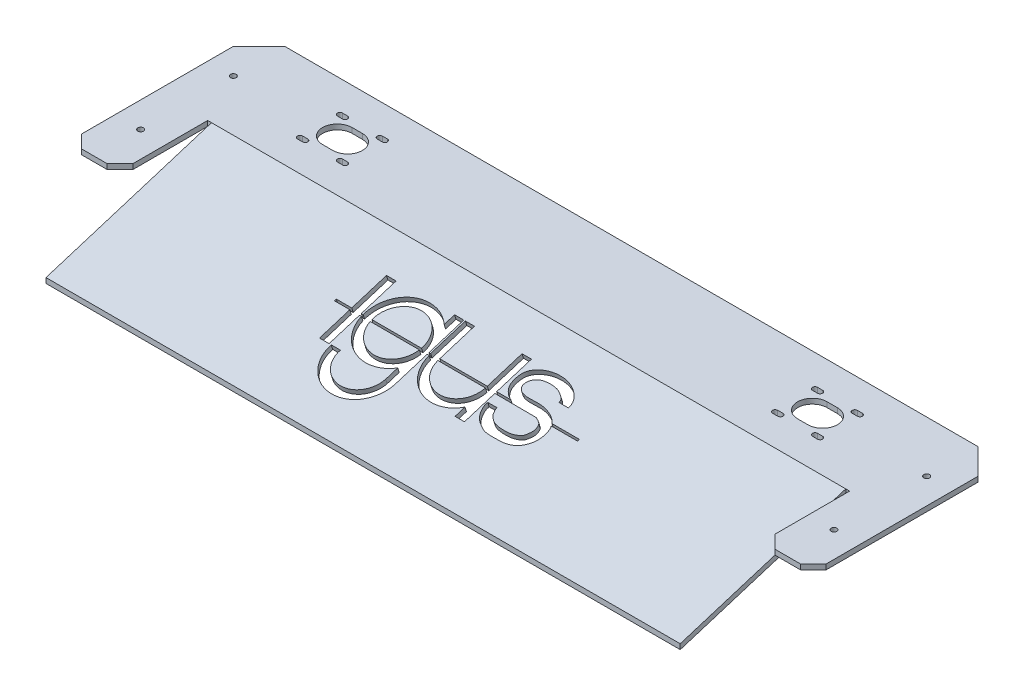
from build123d import *

# Parameters (mm, degrees)
BOSS_EXTRUDE1_DEPTH  = 4
MIRROR6_COPY_1_DEPTH = 4
MIRROR6_COPY_2_DEPTH = 4
SKETCH2_R            = 2.25
CUT_EXTRUDE1_DEPTH   = 44
CHAMFER1_SIZE        = 10
CHAMFER2_SIZE        = 10
SKETCH3_W            = 4.89133335
SKETCH3_H            = 7.534428505
SKETCH3_W_2          = 4.722258617
SKETCH3_W_3          = 4.986234694
SKETCH3_R            = 2.398576227
CUT_EXTRUDE2_DEPTH   = 10
CUT_EXTRUDE3_DEPTH   = 10
BOSS_EXTRUDE2_DEPTH  = 247
CUT_EXTRUDE4_DEPTH   = 494
SKETCH8_W            = 234.885891169
SKETCH8_H            = 80
BOSS_EXTRUDE3_DEPTH  = 4
SKETCH9_W            = 791.232351343
SKETCH9_H            = 194.819885891
CUT_EXTRUDE5_DEPTH   = 139
CHAMFER3_SIZE        = 20


with BuildPart() as part:
    # Sketch1 → Boss-Extrude1 (new body)
    with BuildSketch(Plane(origin=(0, 0, 0), x_dir=(1, 0, 0), z_dir=(0, 1, 0))):
        with BuildLine():
            Line((-290, 108.284271247), (-290, 0))
            Line((-290, 0), (-200.5, 0))
            ThreePointArc((-200.5, 0), (-197.131727984, 8.131727984), (-189, 11.5))
            Line((-189, 11.5), (-181, 11.5))
            ThreePointArc((-181, 11.5), (-172.868272016, 8.131727984), (-169.5, 0))
            Line((-169.5, 0), (0, 0))
            Line((0, 0), (0, 40))
            Line((0, 40), (-221.715728753, 40))
            Line((-221.715728753, 40), (-250, 68.284271247))
            Line((-250, 68.284271247), (-250, 108.284271247))
            Line((-250, 108.284271247), (-290, 108.284271247))
        make_face()
        with BuildLine():
            ThreePointArc((-202.499780644, 13.499780644), (-204.499780644, 15.499780644), (-202.499780644, 17.499780644))
            Line((-202.499780644, 17.499780644), (-198.499780644, 17.499780644))
            ThreePointArc((-198.499780644, 17.499780644), (-196.499780644, 15.499780644), (-198.499780644, 13.499780644))
            Line((-198.499780644, 13.499780644), (-202.499780644, 13.499780644))
        make_face(mode=Mode.SUBTRACT)
        with BuildLine():
            Line((-171.500219356, 17.499780644), (-167.500219356, 17.499780644))
            ThreePointArc((-167.500219356, 17.499780644), (-165.500219356, 15.499780644), (-167.500219356, 13.499780644))
            Line((-167.500219356, 13.499780644), (-171.500219356, 13.499780644))
            ThreePointArc((-171.500219356, 13.499780644), (-173.500219356, 15.499780644), (-171.500219356, 17.499780644))
        make_face(mode=Mode.SUBTRACT)
    boss_extrude1 = extrude(amount=BOSS_EXTRUDE1_DEPTH)

    # Mirror1: Boss-Extrude1 across plane
    add(boss_extrude1.mirror(Plane(origin=(0, 4, 0), x_dir=(1, 0, 0), z_dir=(0, 0, -1))))

    # Mirror5: Boss-Extrude1 across plane
    add(boss_extrude1.mirror(Plane(origin=(0, 4, 0), x_dir=(0, 0, 1), z_dir=(1, 0, 0))))

    # Mirror6 copy 1 sketch → Mirror6 copy 1 (add)
    with BuildSketch(Plane(origin=(0, 0, 0), x_dir=(-1, 0, 0), z_dir=(0, 1, 0))):
        with BuildLine():
            Line((-290, 108.284271247), (-290, 0))
            Line((-290, 0), (-200.5, 0))
            ThreePointArc((-200.5, 0), (-197.131727984, 8.131727984), (-189, 11.5))
            Line((-189, 11.5), (-181, 11.5))
            ThreePointArc((-181, 11.5), (-172.868272016, 8.131727984), (-169.5, 0))
            Line((-169.5, 0), (0, 0))
            Line((0, 0), (0, 40))
            Line((0, 40), (-221.715728753, 40))
            Line((-221.715728753, 40), (-250, 68.284271247))
            Line((-250, 68.284271247), (-250, 108.284271247))
            Line((-250, 108.284271247), (-290, 108.284271247))
        make_face()
        with BuildLine():
            ThreePointArc((-202.499780644, 13.499780644), (-204.499780644, 15.499780644), (-202.499780644, 17.499780644))
            Line((-202.499780644, 17.499780644), (-198.499780644, 17.499780644))
            ThreePointArc((-198.499780644, 17.499780644), (-196.499780644, 15.499780644), (-198.499780644, 13.499780644))
            Line((-198.499780644, 13.499780644), (-202.499780644, 13.499780644))
        make_face(mode=Mode.SUBTRACT)
        with BuildLine():
            Line((-171.500219356, 17.499780644), (-167.500219356, 17.499780644))
            ThreePointArc((-167.500219356, 17.499780644), (-165.500219356, 15.499780644), (-167.500219356, 13.499780644))
            Line((-167.500219356, 13.499780644), (-171.500219356, 13.499780644))
            ThreePointArc((-171.500219356, 13.499780644), (-173.500219356, 15.499780644), (-171.500219356, 17.499780644))
        make_face(mode=Mode.SUBTRACT)
    extrude(amount=MIRROR6_COPY_1_DEPTH)

    # Mirror6 copy 2 sketch → Mirror6 copy 2 (add)
    with BuildSketch(Plane(origin=(0, 0, 0), x_dir=(1, 0, 0), z_dir=(0, 1, 0))):
        with BuildLine():
            Line((-290, -108.284271247), (-290, 0))
            Line((-290, 0), (-200.5, 0))
            ThreePointArc((-200.5, 0), (-197.131727984, -8.131727984), (-189, -11.5))
            Line((-189, -11.5), (-181, -11.5))
            ThreePointArc((-181, -11.5), (-172.868272016, -8.131727984), (-169.5, 0))
            Line((-169.5, 0), (0, 0))
            Line((0, 0), (0, -40))
            Line((0, -40), (-221.715728753, -40))
            Line((-221.715728753, -40), (-250, -68.284271247))
            Line((-250, -68.284271247), (-250, -108.284271247))
            Line((-250, -108.284271247), (-290, -108.284271247))
        make_face()
        with BuildLine():
            ThreePointArc((-202.499780644, -13.499780644), (-204.499780644, -15.499780644), (-202.499780644, -17.499780644))
            Line((-202.499780644, -17.499780644), (-198.499780644, -17.499780644))
            ThreePointArc((-198.499780644, -17.499780644), (-196.499780644, -15.499780644), (-198.499780644, -13.499780644))
            Line((-198.499780644, -13.499780644), (-202.499780644, -13.499780644))
        make_face(mode=Mode.SUBTRACT)
        with BuildLine():
            Line((-171.500219356, -17.499780644), (-167.500219356, -17.499780644))
            ThreePointArc((-167.500219356, -17.499780644), (-165.500219356, -15.499780644), (-167.500219356, -13.499780644))
            Line((-167.500219356, -13.499780644), (-171.500219356, -13.499780644))
            ThreePointArc((-171.500219356, -13.499780644), (-173.500219356, -15.499780644), (-171.500219356, -17.499780644))
        make_face(mode=Mode.SUBTRACT)
    extrude(amount=MIRROR6_COPY_2_DEPTH)

    # Sketch2 → Cut-Extrude1 (cut)
    with BuildSketch(Plane(origin=(0, 4, 0), x_dir=(1, 0, 0), z_dir=(0, 1, 0))):
        with BuildLine():
            ThreePointArc((-267.75, -72.189514165), (-268.409009742, -70.598523907), (-270, -69.939514165))
            Line((-270, -69.939514165), (-270, -72.189514165))
            Line((-270, -72.189514165), (-270, -74.439514165))
            ThreePointArc((-270, -74.439514165), (-268.409009742, -73.780504423), (-267.75, -72.189514165))
        make_face()
        with BuildLine():
            Line((-270, -72.189514165), (-270, -69.939514165))
            ThreePointArc((-270, -69.939514165), (-272.25, -72.189514165), (-270, -74.439514165))
            Line((-270, -74.439514165), (-270, -72.189514165))
        make_face()
        with Locations(Location((-270, 0, 0), (0, 0, 270))):
            Circle(SKETCH2_R)
        with BuildLine():
            ThreePointArc((-270, 74.439514165), (-272.25, 72.189514165), (-270, 69.939514165))
            Line((-270, 69.939514165), (-270, 72.189514165))
            Line((-270, 72.189514165), (-270, 74.439514165))
        make_face()
        with BuildLine():
            Line((-270, 72.189514165), (-270, 69.939514165))
            ThreePointArc((-270, 69.939514165), (-268.409009742, 70.598523907), (-267.75, 72.189514165))
            ThreePointArc((-267.75, 72.189514165), (-268.409009742, 73.780504423), (-270, 74.439514165))
            Line((-270, 74.439514165), (-270, 72.189514165))
        make_face()
    cut_extrude1 = extrude(amount=-CUT_EXTRUDE1_DEPTH, mode=Mode.SUBTRACT)

    # Chamfer1
    chamfer1_edges = [part.edges().sort_by_distance(p)[0] for p in [
        (-290, 2, -108.284271247),
        (-250, 2, -108.284271247),
        (-290, 2, 108.284271247),
        (-250, 2, 108.284271247),
    ]]
    chamfer(chamfer1_edges, length=CHAMFER1_SIZE)

    # Mirror9: Cut-Extrude1 across plane
    add(cut_extrude1.mirror(Plane(origin=(0, 0, 0), x_dir=(0, 0, 1), z_dir=(1, 0, 0))), mode=Mode.SUBTRACT)

    # Chamfer2
    chamfer2_edges = [part.edges().sort_by_distance(p)[0] for p in [
        (290, 2, -108.284271247),
        (250, 2, -108.284271247),
        (250, 2, 108.284271247),
        (290, 2, 108.284271247),
    ]]
    chamfer(chamfer2_edges, length=CHAMFER2_SIZE)

    # Sketch3 → Cut-Extrude2 (cut)
    # profile 1 of 9: a face of its own
    with BuildSketch(Plane(origin=(0, 4, 0), x_dir=(1, 0, 0), z_dir=(0, 1, 0))):
        with BuildLine():
            Line((17.756292578, 19.05072103), (13.034033961, 19.05072103))
            Line((13.034033961, 19.05072103), (13.034033961, 7.690043412))
            Line((13.034033961, 7.690043412), (12.186922475, 7.690043412))
            Line((12.186922475, 7.690043412), (12.186922475, 6.673634872))
            Line((12.186922475, 6.673634872), (13.225704841, 6.673634872))
            ThreePointArc((13.225704841, 6.673634872), (24.116047648, -8.695675291), (42.460223463, -4.417068623))
            Line((42.460223463, -4.417068623), (42.460223463, -9.82377172))
            Line((42.460223463, -9.82377172), (47.351556813, -9.82377172))
            Line((47.351556813, -9.82377172), (47.351556813, 6.673634872))
            Line((47.351556813, 6.673634872), (69.025260991, 6.577857233))
            add(Edge.make_bspline(
                [(53.065115514, 1.992023577), (52.881837045, 1.062447323), (53.465286783, -0.024014), (54.104109076, -1.49188122), (54.980355207, -2.267471592), (55.990558487, -3.253822675), (57.452703304, -4.003429754), (59.394774923, -4.52432428), (61.614526466, -4.708300775), (64.133123091, -4.769461908), (66.61763139, -4.538941365), (68.828544546, -3.78251384), (70.965531795, -2.816690556), (71.985481287, -0.789058617), (72.789638663, 1.157030101), (72.696348399, 3.064497119), (72.029797832, 5.473319111), (69.935664737, 6.048250566), (69.025260991, 6.577857233)],
                knots=[0, 0, 0, 0, 0.081184108, 0.10790483, 0.143900876, 0.185103716, 0.23586594, 0.290215762, 0.366526158, 0.436729253, 0.51873906, 0.590001951, 0.649430214, 0.723575416, 0.786665555, 0.838093389, 0.894821875, 1, 1, 1, 1], degree=3))
            Line((53.065115514, 1.992023577), (48.176767212, 1.992023577))
            add(Edge.make_bspline(
                [(76.689802119, 6.673634872), (76.776720841, 6.515309476), (77.346082491, 5.379089539), (77.842385043, 2.775098219), (77.495708471, -0.969732888), (75.84192986, -4.323913716), (73.376942523, -6.987464077), (70.475703458, -8.580791803), (67.383864983, -9.28319435), (63.916433002, -9.449948165), (60.249662271, -9.506502989), (56.621049626, -9.147945731), (53.7606345, -7.582775153), (51.081460509, -5.941045539), (48.808288636, -2.537264498), (47.91057008, 0.166586441), (48.176767212, 1.992023577)],
                knots=[0.511379909, 0.511379909, 0.511379909, 0.511379909, 0.516990878, 0.550897762, 0.592186626, 0.63231135, 0.665073685, 0.704086852, 0.733344431, 0.763283971, 0.812029986, 0.848328531, 0.874618577, 0.91298076, 0.944693495, 1, 1, 1, 1], degree=3))
            Line((76.689802119, 6.673634872), (82.483953867, 6.673634872))
            Line((82.483953867, 6.673634872), (82.483953867, 7.690043412))
            Line((82.483953867, 7.690043412), (76.019711163, 7.690043412))
            add(Edge.make_bspline(
                [(54.711643622, 19.05072103), (54.228336507, 18.492948034), (53.432038562, 17.131039988), (53.374474987, 14.851467964), (54.797016983, 13.113774771), (58.599264933, 11.576030604), (64.211750858, 12.572849086), (70.285584626, 11.558006557), (74.079668595, 9.742953229), (75.581729127, 8.253961347), (76.019711163, 7.690043412)],
                knots=[0.197684265, 0.197684265, 0.197684265, 0.197684265, 0.220521746, 0.245718615, 0.26280001, 0.287259547, 0.369622478, 0.434467432, 0.476788021, 0.498807658, 0.498807658, 0.498807658, 0.498807658], degree=3))
            Line((54.711643622, 19.05072103), (49.132787671, 19.05072103))
            add(Edge.make_bspline(
                [(49.132787671, 19.05072103), (48.839053253, 17.885586508), (48.737005594, 15.70465507), (49.393762237, 11.111054491), (52.39797666, 8.519920076), (54.705573707, 7.690043412)],
                knots=[0.713647859, 0.713647859, 0.713647859, 0.713647859, 0.787926735, 0.842679623, 1, 1, 1, 1], degree=3))
            Line((54.705573707, 7.690043412), (47.351556813, 7.690043412))
            Line((47.351556813, 7.690043412), (47.351556813, 19.05072103))
            Line((47.351556813, 19.05072103), (42.460223463, 19.05072103))
            Line((42.460223463, 19.05072103), (42.460223463, 7.690043412))
            Line((42.460223463, 7.690043412), (17.756292578, 7.690043412))
            Line((17.756292578, 7.690043412), (17.756292578, 19.05072103))
        make_face()
        with BuildLine():
            ThreePointArc((42.453173513, 6.673634872), (30.105024404, -5.264242546), (17.756875295, 6.673634872))
            Line((17.756875295, 6.673634872), (42.453173513, 6.673634872))
        make_face(mode=Mode.SUBTRACT)
    # profile 2 of 9: a face of its own
    with BuildSketch(Plane(origin=(0, 4, 0), x_dir=(1, 0, 0), z_dir=(0, 1, 0))):
        with BuildLine():
            Line((-22.946213844, 19.05072103), (-27.932448538, 19.05072103))
            Line((-27.932448538, 19.05072103), (-27.932448538, 7.690043412))
            Line((-27.932448538, 7.690043412), (-35.931837929, 7.690043412))
            Line((-35.931837929, 7.690043412), (-35.931837929, 6.673634872))
            Line((-35.931837929, 6.673634872), (-27.932448538, 6.673634872))
            Line((-27.932448538, 6.673634872), (-27.932448538, -9.82377172))
            Line((-27.932448538, -9.82377172), (-22.946213844, -9.82377172))
            Line((-22.946213844, -9.82377172), (-22.946213844, 6.673634872))
            Line((-22.946213844, 6.673634872), (-21.948820324, 6.673634872))
            ThreePointArc((-21.948820324, 6.673634872), (-10.703931008, -8.020841554), (7.425571711, -4.319989716))
            Line((7.425571711, -4.319989716), (7.425571711, -10.878511442))
            ThreePointArc((7.425571711, -10.878511442), (-5.357108304, -22.606451736), (-17.085048598, -9.82377172))
            Line((-17.085048598, -9.82377172), (-21.846399362, -9.82377172))
            ThreePointArc((-21.846399362, -9.82377172), (-5.357108304, -27.3678025), (12.186922475, -10.878511442))
            Line((12.186922475, -10.878511442), (12.186922475, 6.673634872))
            Line((12.186922475, 6.673634872), (12.186922475, 7.690043412))
            Line((12.186922475, 7.690043412), (12.186922475, 19.05072103))
            Line((12.186922475, 19.05072103), (2.513227227, 19.05072103))
            ThreePointArc((2.513227227, 19.05072103), (6.896441183, 14.132295136), (8.275161815, 7.690043412))
            Line((8.275161815, 7.690043412), (-17.463188566, 7.690043412))
            ThreePointArc((-17.463188566, 7.690043412), (-16.084467934, 14.132295136), (-11.701253978, 19.05072103))
            Line((-11.701253978, 19.05072103), (-18.318763594, 19.05072103))
            ThreePointArc((-18.318763594, 19.05072103), (-21.170258302, 13.696875268), (-22.01444878, 7.690043412))
            Line((-22.01444878, 7.690043412), (-22.946213844, 7.690043412))
            Line((-22.946213844, 7.690043412), (-22.946213844, 19.05072103))
        make_face()
        with BuildLine():
            ThreePointArc((8.186183206, 6.673634872), (-4.594013375, -4.579297807), (-17.374209956, 6.673634872))
            Line((-17.374209956, 6.673634872), (8.186183206, 6.673634872))
        make_face(mode=Mode.SUBTRACT)
    # profile 3 of 9: a face of its own
    with BuildSketch(Plane(origin=(0, 4, 0), x_dir=(1, 0, 0), z_dir=(0, 1, 0))):
        with BuildLine():
            add(Edge.make_bspline(
                [(75.926908033, 16.711887446), (75.98198398, 17.533071739), (75.87815744, 18.314387372), (75.647457481, 19.05072103)],
                knots=[0, 0, 0, 0, 0.048614378, 0.048614378, 0.048614378, 0.048614378], degree=3))
            Line((75.647457481, 19.05072103), (69.828511328, 19.05072103))
            add(Edge.make_bspline(
                [(70.902358123, 16.711887446), (71.166450288, 17.527072406), (70.619011269, 18.36228737), (69.932996585, 18.965212767), (69.828511328, 19.05072103)],
                knots=[0, 0, 0, 0, 0.023973978, 0.028160225, 0.028160225, 0.028160225, 0.028160225], degree=3))
            Line((70.902358123, 16.711887446), (75.926908033, 16.711887446))
        make_face()
    # profile 4 of 9: a face of its own
    with BuildSketch(Plane(origin=(0, 4, 0), x_dir=(1, 0, 0), z_dir=(0, 1, 0))):
        with BuildLine():
            add(Edge.make_bspline(
                [(75.647457481, 19.05072103), (74.8610236, 21.560811367), (70.159759986, 25.693522362), (61.769498524, 27.189063275), (54.345606328, 25.369162718), (50.102002584, 21.86707642), (49.281229323, 19.639533517), (49.132787671, 19.05072103)],
                knots=[0.048614378, 0.048614378, 0.048614378, 0.048614378, 0.214336098, 0.393230308, 0.565847142, 0.676110279, 0.713647859, 0.713647859, 0.713647859, 0.713647859], degree=3))
            Line((49.132787671, 19.05072103), (54.711643622, 19.05072103))
            add(Edge.make_bspline(
                [(69.828511328, 19.05072103), (69.460610839, 19.351802088), (68.44441553, 19.988567659), (66.290510676, 21.191963116), (63.448419319, 21.636606986), (60.184054731, 21.526555102), (57.263617202, 21.092430186), (55.428580667, 19.838629095), (54.781454546, 19.131288121), (54.711643622, 19.05072103)],
                knots=[0.028160225, 0.028160225, 0.028160225, 0.028160225, 0.04290032, 0.065706797, 0.10450496, 0.130316026, 0.168033853, 0.194385522, 0.197684265, 0.197684265, 0.197684265, 0.197684265], degree=3))
            Line((69.828511328, 19.05072103), (75.647457481, 19.05072103))
        make_face()
    # profile 5 of 9: a face of its own
    with BuildSketch(Plane(origin=(0, 4, 0), x_dir=(1, 0, 0), z_dir=(0, 1, 0))):
        with Locations((44.905890138, 22.817935283)):
            Rectangle(SKETCH3_W, SKETCH3_H)
    # profile 6 of 9: a face of its own
    with BuildSketch(Plane(origin=(0, 4, 0), x_dir=(1, 0, 0), z_dir=(0, 1, 0))):
        with Locations((15.395163269, 22.817935283)):
            Rectangle(SKETCH3_W_2, SKETCH3_H)
    # profile 7 of 9: a face of its own
    with BuildSketch(Plane(origin=(0, 4, 0), x_dir=(1, 0, 0), z_dir=(0, 1, 0))):
        with BuildLine():
            ThreePointArc((7.425571711, 20.929069677), (-5.862455507, 25.689597653), (-18.318763594, 19.05072103))
            Line((-18.318763594, 19.05072103), (-11.701253978, 19.05072103))
            ThreePointArc((-11.701253978, 19.05072103), (-4.594013375, 21.188377767), (2.513227227, 19.05072103))
            Line((2.513227227, 19.05072103), (12.186922475, 19.05072103))
            Line((12.186922475, 19.05072103), (12.186922475, 26.585149535))
            Line((12.186922475, 26.585149535), (7.425571711, 26.585149535))
            Line((7.425571711, 26.585149535), (7.425571711, 20.929069677))
        make_face()
    # profile 8 of 9: a face of its own
    with BuildSketch(Plane(origin=(0, 4, 0), x_dir=(1, 0, 0), z_dir=(0, 1, 0))):
        with Locations((-25.439331191, 22.817935283)):
            Rectangle(SKETCH3_W_3, SKETCH3_H)
    # profile 9 of 9: a face of its own
    with BuildSketch(Plane(origin=(0, 4, 0), x_dir=(1, 0, 0), z_dir=(0, 1, 0))):
        with Locations(Location((-25.580451041, 32.418103328, 0), (0, 0, 270))):
            Circle(SKETCH3_R)
    extrude(amount=-CUT_EXTRUDE2_DEPTH, mode=Mode.SUBTRACT)


with BuildPart() as cut_extrude2_piece_1:
    # of the separate pieces the step leaves, piece 1, a body of its own (cut_extrude2_pieces)
    add(part.part.solids().sort_by_distance((250, 0, -98.284271247))[0])

    # Sketch5 → Cut-Extrude3 (cut)
    with BuildSketch(Plane(origin=(0, 4, 0), x_dir=(1, 0, 0), z_dir=(0, 1, 0))):
        Polygon((-250, -68.284271247), (-221.715728753, -40), (-250, -40), align=None)
        Polygon((221.715728753, -40), (250, -68.284271247), (250, -40), align=None)
    extrude(amount=-CUT_EXTRUDE3_DEPTH, mode=Mode.SUBTRACT)

    # Sketch6 → Boss-Extrude2 (add, symmetric)
    with BuildSketch(Plane(origin=(0, 0, 0), x_dir=(0, 0, -1), z_dir=(1, 0, 0))):
        Polygon((-40, 4), (-168.937969582, -36), (-168.937969582, -40), (-40, 0), align=None)
    extrude(amount=BOSS_EXTRUDE2_DEPTH, both=True)

    # Sketch7 → Cut-Extrude4 (cut)
    # profile 1 of 2: a face of its own
    with BuildSketch(Plane(origin=(0, 14.968491157, 4.643625522), x_dir=(1, 0, 0), z_dir=(0, 0.9550960709798243, 0.29629629629629645))):
        with BuildLine():
            Line((-76.620361052, -94.775659486), (-75.124270772, -94.775659486))
            ThreePointArc((-75.124270772, -94.775659486), (-58.256936797, -116.817374125), (-31.062682719, -111.266096368))
            Line((-31.062682719, -111.266096368), (-31.062682719, -121.103878957))
            ThreePointArc((-31.062682719, -121.103878957), (-50.236702742, -138.695789398), (-67.828613183, -119.521769375))
            Line((-67.828613183, -119.521769375), (-74.970639329, -119.521769375))
            ThreePointArc((-74.970639329, -119.521769375), (-50.236702742, -145.837815544), (-23.920656573, -121.103878957))
            Line((-23.920656573, -121.103878957), (-23.920656573, -64.908387492))
            Line((-23.920656573, -64.908387492), (-31.062682719, -64.908387492))
            Line((-31.062682719, -64.908387492), (-31.062682719, -73.392507279))
            ThreePointArc((-31.062682719, -73.392507279), (-59.815775322, -68.482654627), (-75.222713455, -93.251046677))
            Line((-75.222713455, -93.251046677), (-76.620361052, -93.251046677))
            Line((-76.620361052, -93.251046677), (-76.620361052, -64.908387491))
            Line((-76.620361052, -64.908387491), (-84.099713093, -64.908387491))
            Line((-84.099713093, -64.908387491), (-84.099713093, -93.251046677))
            Line((-84.099713093, -93.251046677), (-96.098797179, -93.251046677))
            Line((-96.098797179, -93.251046677), (-96.098797179, -94.775659486))
            Line((-96.098797179, -94.775659486), (-84.099713093, -94.775659486))
            Line((-84.099713093, -94.775659486), (-84.099713093, -119.521769375))
            Line((-84.099713093, -119.521769375), (-76.620361052, -119.521769375))
            Line((-76.620361052, -119.521769375), (-76.620361052, -94.775659486))
        make_face()
        with BuildLine():
            ThreePointArc((-29.788297563, -93.251046677), (-49.092060349, -73.003545143), (-68.395823135, -93.251046677))
            Line((-68.395823135, -93.251046677), (-29.788297563, -93.251046677))
        make_face(mode=Mode.SUBTRACT)
        with BuildLine():
            ThreePointArc((-68.26235522, -94.775659486), (-49.092060349, -111.655058504), (-29.921765477, -94.775659486))
            Line((-29.921765477, -94.775659486), (-68.26235522, -94.775659486))
        make_face(mode=Mode.SUBTRACT)
    # profile 2 of 2: a face of its own
    with BuildSketch(Plane(origin=(0, 14.968491157, 4.643625522), x_dir=(1, 0, 0), z_dir=(0, 0.9550960709798243, 0.29629629629629645))):
        with BuildLine():
            Line((-23.920656573, -93.251046677), (-23.920656573, -94.775659486))
            Line((-23.920656573, -94.775659486), (-22.362483025, -94.775659486))
            ThreePointArc((-22.362483025, -94.775659486), (-6.026968814, -117.829624731), (21.489294908, -111.411714729))
            Line((21.489294908, -111.411714729), (21.489294908, -119.521769375))
            Line((21.489294908, -119.521769375), (28.826294934, -119.521769375))
            Line((28.826294934, -119.521769375), (28.826294934, -94.775659487))
            Line((28.826294934, -94.775659487), (61.3368512, -94.919325946))
            add(Edge.make_bspline(
                [(37.396632985, -101.798076429), (37.121715281, -103.19244081), (37.996889889, -104.822132794), (38.955123328, -107.023933625), (40.269492526, -108.187319182), (41.784797445, -109.666845807), (43.978014671, -110.791256425), (46.891122099, -111.572598214), (50.220749413, -111.848562957), (53.99864435, -111.940304656), (57.7254068, -111.594523842), (61.041776534, -110.459882554), (64.247257408, -109.011147629), (65.777181645, -105.969699719), (66.983417709, -103.050566642), (66.843482312, -100.189366116), (65.843656462, -96.576133129), (62.70245682, -95.713735945), (61.3368512, -94.919325946)],
                knots=[0, 0, 0, 0, 0.081184108, 0.10790483, 0.143900876, 0.185103716, 0.23586594, 0.290215762, 0.366526158, 0.436729253, 0.51873906, 0.590001951, 0.649430214, 0.723575416, 0.786665555, 0.838093389, 0.894821875, 1, 1, 1, 1], degree=3))
            Line((37.396632985, -101.798076429), (30.064110533, -101.798076429))
            add(Edge.make_bspline(
                [(72.833662893, -94.775659486), (72.964040976, -95.013147581), (73.818083451, -96.717477486), (74.56253728, -100.623464466), (74.042522421, -106.240711126), (71.561854504, -111.271982369), (67.864373499, -115.26730791), (63.512514902, -117.657299499), (58.874757189, -118.71090332), (53.673609218, -118.961034042), (48.17345312, -119.045866279), (42.730534153, -118.508030392), (38.439911464, -116.160274525), (34.421150478, -113.697680102), (31.011392668, -108.592008542), (29.664814834, -104.536232133), (30.064110533, -101.798076429)],
                knots=[0.511379909, 0.511379909, 0.511379909, 0.511379909, 0.516990878, 0.550897762, 0.592186626, 0.63231135, 0.665073685, 0.704086852, 0.733344431, 0.763283971, 0.812029986, 0.848328531, 0.874618577, 0.91298076, 0.944693495, 1, 1, 1, 1], degree=3))
            Line((72.833662893, -94.775659486), (93.142300858, -94.775659486))
            Line((93.142300858, -94.775659486), (93.142300858, -93.251046677))
            Line((93.142300858, -93.251046677), (71.828526459, -93.251046677))
            add(Edge.make_bspline(
                [(64.152496899, -79.718280625), (64.548635146, -78.495503186), (63.297652127, -76.586907522), (60.642742168, -74.902239853), (57.234725728, -72.99816712), (52.971588693, -72.331201315), (48.075041811, -72.496279142), (43.694385517, -73.147466516), (40.008729011, -75.665716185), (37.951391785, -78.916328253), (37.860672194, -82.508909849), (39.994485189, -85.115449637), (45.697857114, -87.422065889), (54.116586002, -85.926838165), (63.227336653, -87.449101958), (68.918462607, -90.171681951), (71.171553404, -92.405169774), (71.828526459, -93.251046677)],
                knots=[0, 0, 0, 0, 0.023973978, 0.04290032, 0.065706797, 0.10450496, 0.130316026, 0.168033853, 0.194385522, 0.220521746, 0.245718615, 0.26280001, 0.287259547, 0.369622478, 0.434467432, 0.476788021, 0.498807658, 0.498807658, 0.498807658, 0.498807658], degree=3))
            Line((64.152496899, -79.718280625), (71.689321764, -79.718280625))
            add(Edge.make_bspline(
                [(71.689321764, -79.718280625), (72.053558559, -74.287497246), (64.221492684, -66.456675657), (50.453207501, -64.002516883), (39.317369206, -66.732367717), (31.476341618, -73.203272387), (30.775327872, -80.325874297), (31.889603071, -88.119530058), (36.395924704, -92.00623168), (39.857320275, -93.251046677)],
                knots=[0, 0, 0, 0, 0.214336098, 0.393230308, 0.565847142, 0.676110279, 0.787926735, 0.842679623, 1, 1, 1, 1], degree=3))
            Line((39.857320275, -93.251046677), (28.826294934, -93.251046677))
            Line((28.826294934, -93.251046677), (28.826294934, -64.908387491))
            Line((28.826294934, -64.908387491), (21.489294908, -64.908387491))
            Line((21.489294908, -64.908387491), (21.489294908, -93.251046677))
            Line((21.489294908, -93.251046677), (-15.566601419, -93.251046677))
            Line((-15.566601419, -93.251046677), (-15.566601419, -64.908387492))
            Line((-15.566601419, -64.908387492), (-22.649989344, -64.908387492))
            Line((-22.649989344, -64.908387492), (-22.649989344, -93.251046677))
            Line((-22.649989344, -93.251046677), (-23.920656573, -93.251046677))
        make_face()
        with BuildLine():
            ThreePointArc((21.478719984, -94.775659486), (2.956496321, -112.682475613), (-15.565727342, -94.775659486))
            Line((-15.565727342, -94.775659486), (21.478719984, -94.775659486))
        make_face(mode=Mode.SUBTRACT)
    extrude(amount=-CUT_EXTRUDE4_DEPTH, mode=Mode.SUBTRACT)


with BuildPart() as cut_extrude2_piece_2:
    # of the separate pieces the step leaves, piece 2, a body of its own (cut_extrude2_pieces)
    add(part.part.solids().sort_by_distance((8.275161815, 0, -7.690043412))[0])



with BuildPart() as cut_extrude2_piece_3:
    # of the separate pieces the step leaves, piece 3, a body of its own (cut_extrude2_pieces)
    add(part.part.solids().sort_by_distance((17.756875295, 0, -6.673634872))[0])


with BuildPart() as cut_extrude2_piece_4:
    # of the separate pieces the step leaves, piece 4, a body of its own (cut_extrude2_pieces)
    add(part.part.solids().sort_by_distance((-17.374209956, 0, -6.673634872))[0])


with BuildPart() as cut_extrude4_piece_1:
    # of the separate pieces the step leaves, piece 1, a body of its own (cut_extrude4_pieces)
    add(cut_extrude2_piece_1.part.solids().sort_by_distance((250, 0, -98.284271247))[0])


with BuildPart() as cut_extrude4_piece_2:
    # of the separate pieces the step leaves, piece 2, a body of its own (cut_extrude4_pieces)
    add(cut_extrude2_piece_1.part.solids().sort_by_distance((-29.788297563, -16.310282619, 92.575368104))[0])


with BuildPart() as cut_extrude4_piece_3:
    # of the separate pieces the step leaves, piece 3, a body of its own (cut_extrude4_pieces)
    add(cut_extrude2_piece_1.part.solids().sort_by_distance((-15.565727342, -16.762019747, 94.031519808))[0])


with BuildPart() as cut_extrude4_piece_4:
    # of the separate pieces the step leaves, piece 4, a body of its own (cut_extrude4_pieces)
    add(cut_extrude2_piece_1.part.solids().sort_by_distance((-68.26235522, -16.762019747, 94.031519808))[0])


with BuildPart() as cut_extrude2_piece_2_1:
    add(cut_extrude2_piece_2.part)

    add(cut_extrude2_piece_3.part)  # Boss-Extrude3 merges Cut-Extrude2 piece 3

    add(cut_extrude2_piece_4.part)  # Boss-Extrude3 merges Cut-Extrude2 piece 4

    add(cut_extrude4_piece_1.part)  # Boss-Extrude3 merges Cut-Extrude4 piece 1
    # Sketch8 → Boss-Extrude3 (add)
    with BuildSketch(Plane(origin=(0, 4, 0), x_dir=(1, 0, 0), z_dir=(0, 1, 0))):
        with Locations((-0.257866374, 0)):
            Rectangle(SKETCH8_W, SKETCH8_H)
    extrude(amount=-BOSS_EXTRUDE3_DEPTH)

    # Sketch9 → Cut-Extrude5 (cut)
    with BuildSketch(Plane(origin=(0, 4, 0), x_dir=(1, 0, 0), z_dir=(0, 1, 0))):
        with Locations((3.778514768, 137.409942946)):
            Rectangle(SKETCH9_W, SKETCH9_H)
    extrude(amount=-CUT_EXTRUDE5_DEPTH, mode=Mode.SUBTRACT)

    # Chamfer3
    chamfer3_edges = [cut_extrude2_piece_2_1.edges().sort_by_distance(p)[0] for p in [
        (-290, 2, -40),
        (290, 2, -40),
    ]]
    chamfer(chamfer3_edges, length=CHAMFER3_SIZE)


solid = Compound([cut_extrude4_piece_2.part, cut_extrude4_piece_3.part, cut_extrude4_piece_4.part, cut_extrude2_piece_2_1.part])
